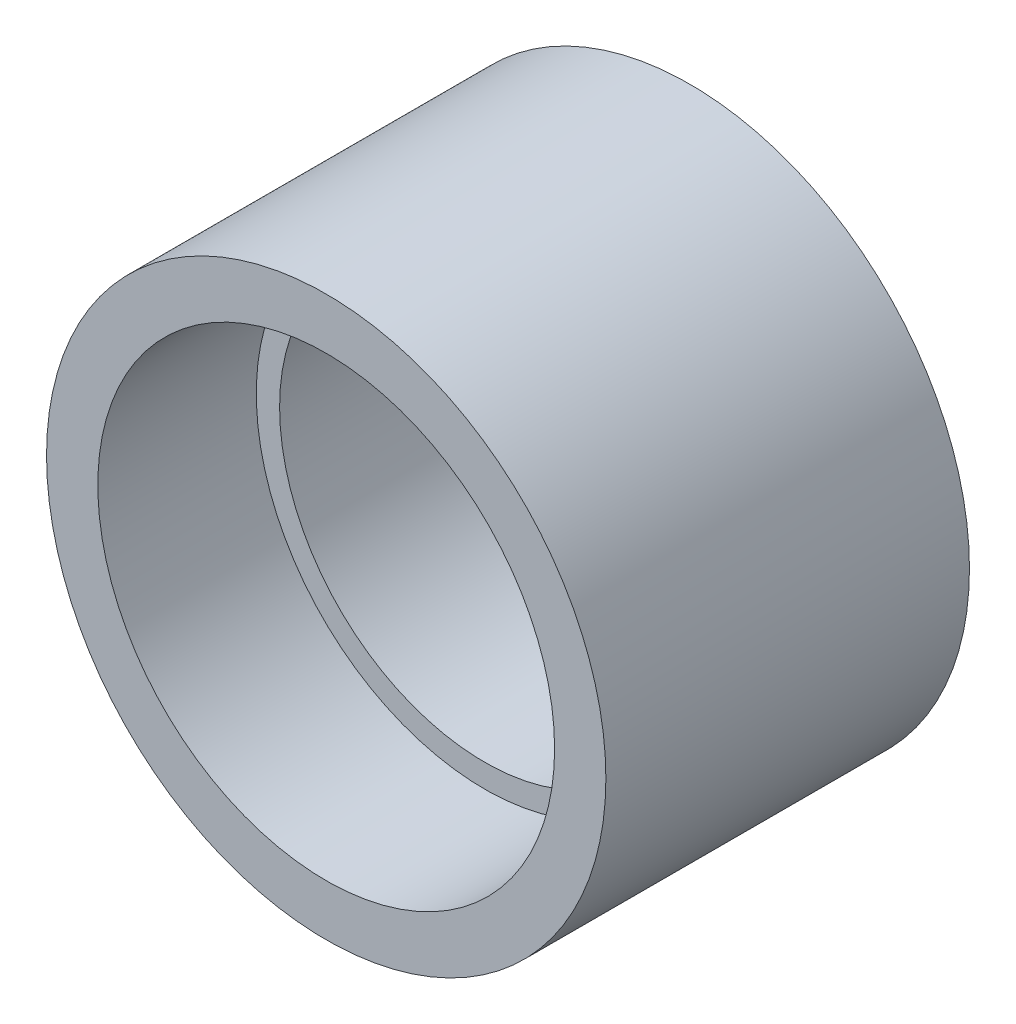
from build123d import *
from build123d.topology import SkipClean

# Parameters (mm, degrees)
CROQUIS1_R              = 15
CROQUIS1_R_2            = 11
SALIENTE_EXTRUIR1_DEPTH = 10
CROQUIS2_R              = 15
SALIENTE_EXTRUIR2_DEPTH = 1
CROQUIS3_R              = 15
CROQUIS3_R_2            = 12.25
SALIENTE_EXTRUIR3_DEPTH = 8.5


with BuildPart() as part:
    # Croquis1 → Saliente-Extruir1 (new body)
    with BuildSketch(Plane.XY):
        Circle(CROQUIS1_R)
        Circle(CROQUIS1_R_2, mode=Mode.SUBTRACT)
    extrude(amount=SALIENTE_EXTRUIR1_DEPTH)

    # Croquis2 → Saliente-Extruir2 (add, symmetric)
    with SkipClean():  # the faces are left unmerged after this step: merging them gives an invalid solid
        with BuildSketch(Plane(origin=(0, 0, 0), x_dir=(-1, 0, 0), z_dir=(0, 0, -1))):
            Circle(CROQUIS2_R)
        extrude(amount=SALIENTE_EXTRUIR2_DEPTH, both=True)

    # Croquis3 → Saliente-Extruir3 (add)
    with SkipClean():  # the faces are left unmerged after this step: merging them gives an invalid solid
        with BuildSketch(Plane.XY.offset(10)):
            with Locations(Location((0, 0, 0), (0, 0, 180))):
                Circle(CROQUIS3_R)
            Circle(CROQUIS3_R_2, mode=Mode.SUBTRACT)
        extrude(amount=SALIENTE_EXTRUIR3_DEPTH)


solid = part.part
